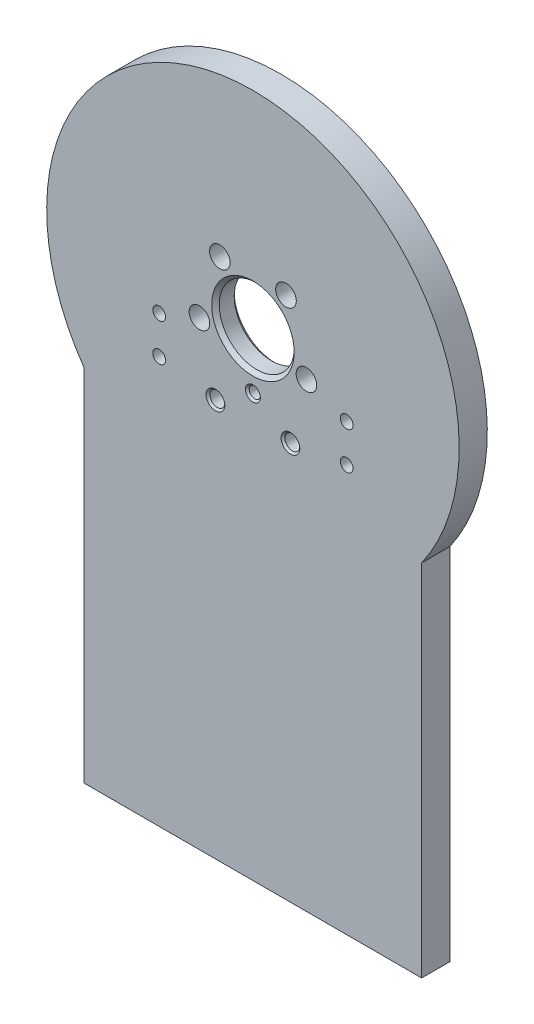
from build123d import *

# Parameters (mm, degrees)
SKETCH_2_R                = 150
EXTRUDE_1_DEPTH           = 15
SKETCH_3_R                = 35
CUT_EXTRUDE_1_DEPTH       = 3
EXTRUDE_START             = 16.5
SKETCH_4_R                = 38.5
SKETCH_4_R_2              = 35
EXTRUDE_2_DEPTH           = 16.5
EXTRUDE_START_2           = 13.5
SKETCH_5_R                = 46.5
SKETCH_5_R_2              = 38.5
EXTRUDE_3_DEPTH           = 13.5
CHAMFER_1_SIZE            = 0.5
HOLE_WIZARD_1_D           = 6.6
HOLE_WIZARD_1_CBORE_D     = 11
HOLE_WIZARD_1_CBORE_DEPTH = 8
HOLE_WIZARD_6_0_6_1_D     = 6
CHAMFER_3_SIZE            = 1
CUT_EXTRUDE_START         = 69
SKETCH_20_R               = 46.5
CUT_EXTRUDE_5_DEPTH       = 69
SKETCH_22_R               = 4
CUT_EXTRUDE_7_DEPTH       = 244.812402925
CHAMFER_6_SIZE            = 1
HOLE_WIZARD_M8_1_D        = 6.8
EXTRUDE_START_3           = 5
SKETCH_27_R               = 40
SKETCH_27_R_2             = 35
EXTRUDE_4_DEPTH           = 5
CHAMFER_7_SIZE            = 0.5
CHAMFER_8_SIZE            = 2
SKETCH_25_R               = 20
CUT_EXTRUDE_8_DEPTH       = 245.171021663
CHAMFER_9_SIZE            = 2
FILLET_1_R                = 1
SKETCH_28_OUTSIDE_W       = 386.948
SKETCH_28_OUTSIDE_H       = 386.948
SKETCH_28_OUTSIDE_R       = 110
CUT_EXTRUDE_9_DEPTH       = 245.171021663
SKETCH_29_W               = 180
SKETCH_29_H               = 198.338891977
EXTRUDE_5_DEPTH           = 15


with BuildPart() as part:
    # 草图2 → 凸台-拉伸1 (new body)
    with BuildSketch(Plane.XY.offset(1)):
        with Locations((18.556612769, -25.522523089)):
            Circle(SKETCH_2_R)
    extrude(amount=EXTRUDE_1_DEPTH)

    # 草图3 → 切除-拉伸1 (cut)
    with BuildSketch(Plane(origin=(0, 0, 1), x_dir=(-1, 0, 0), z_dir=(0, 0, -1))):
        with Locations((-18.556612769, -25.522523089)):
            Circle(SKETCH_3_R)
    extrude(amount=-CUT_EXTRUDE_1_DEPTH, mode=Mode.SUBTRACT)

    # 草图4 → 凸台-拉伸2 (add)
    with BuildSketch(Plane(origin=(0, 0, 1), x_dir=(-1, 0, 0), z_dir=(0, 0, -1)).offset(EXTRUDE_START)):
        with Locations(Location((-18.556612769, -25.522523089, 0), (0, 0, 180))):
            Circle(SKETCH_4_R)
        with Locations((-18.556612769, -25.522523089)):
            Circle(SKETCH_4_R_2, mode=Mode.SUBTRACT)
    extrude(amount=-EXTRUDE_2_DEPTH)

    # 草图5 → 凸台-拉伸3 (add)
    with BuildSketch(Plane(origin=(0, 0, 1), x_dir=(-1, 0, 0), z_dir=(0, 0, -1)).offset(EXTRUDE_START_2)):
        with Locations(Location((-18.556612769, -25.522523089, 0), (0, 0, 180))):
            Circle(SKETCH_5_R)
        with Locations(Location((-18.556612769, -25.522523089, 0), (0, 0, 90))):
            Circle(SKETCH_5_R_2, mode=Mode.SUBTRACT)
    extrude(amount=-EXTRUDE_3_DEPTH)

    # 倒角1
    chamfer_1_edges = [part.edges().sort_by_distance(p)[0] for p in [
        (53.556612769, -25.522523089, -15.5),
        (-19.943387231, -25.522523089, -15.5),
    ]]
    chamfer(chamfer_1_edges, length=CHAMFER_1_SIZE)

    # 打孔尺寸根据内六角圆柱头螺钉的类型1 (through all)
    with Locations(Plane(origin=(42.626407432, -13.463363362, 16), x_dir=(1, 0, 0), z_dir=(0, 0, 1))):
        with Locations((-41.703352232, 12.211350104), (-6.436237094, 12.211350104), (4.461900826, -21.329669558), (-52.601490152, -21.329669558)):
            CounterBoreHole(HOLE_WIZARD_1_D / 2, HOLE_WIZARD_1_CBORE_D / 2, HOLE_WIZARD_1_CBORE_DEPTH)

    # Ø6.0 (6) 直径孔1 (through all)
    with Locations(Plane.XY.offset(16)):
        with Locations((18.556612769, -55.522523089)):
            Hole(HOLE_WIZARD_6_0_6_1_D / 2)

    # 倒角3
    chamfer_3_edges = [part.edges().sort_by_distance(p)[0] for p in [
        (21.556612769, -55.522523089, 16),
    ]]
    chamfer(chamfer_3_edges, length=CHAMFER_3_SIZE)

    # 草图20 → 切除-拉伸5 (cut)
    with BuildSketch(Plane(origin=(0, 0, 1), x_dir=(-1, 0, 0), z_dir=(0, 0, -1)).offset(CUT_EXTRUDE_START)):
        with Locations((-18.556612769, -25.522523089)):
            Circle(SKETCH_20_R)
    extrude(amount=-CUT_EXTRUDE_5_DEPTH, mode=Mode.SUBTRACT)

    # 草图22 → 切除-拉伸7 (cut, through all)
    with BuildSketch(Plane.XY.offset(16)):
        with Locations((-1.443387231, -68.522523089)):
            Circle(SKETCH_22_R)
        with Locations((38.556612769, -68.522523089)):
            Circle(SKETCH_22_R)
    extrude(amount=-CUT_EXTRUDE_7_DEPTH, mode=Mode.SUBTRACT)

    # 倒角6
    chamfer_6_edges = [part.edges().sort_by_distance(p)[0] for p in [
        (-5.443387231, -68.522523089, 16),
        (34.556612769, -68.522523089, 16),
    ]]
    chamfer(chamfer_6_edges, length=CHAMFER_6_SIZE)

    # M8 螺纹孔1 (through all)
    with Locations(Plane.XY.offset(16)):
        with Locations((-31.443387231, -43.522523089), (-31.443387231, -63.522523089), (68.556612769, -43.522523089), (68.556612769, -63.522523089), (18.556612769, -25.522523089)):
            Hole(HOLE_WIZARD_M8_1_D / 2)

    # 草图27 → 凸台-拉伸4 (add)
    with BuildSketch(Plane(origin=(0, 0, 1), x_dir=(-1, 0, 0), z_dir=(0, 0, -1)).offset(EXTRUDE_START_3)):
        with Locations(Location((-18.556612769, -25.522523089, 0), (0, 0, 180))):
            Circle(SKETCH_27_R)
        with Locations((-18.556612769, -25.522523089)):
            Circle(SKETCH_27_R_2, mode=Mode.SUBTRACT)
    extrude(amount=-EXTRUDE_4_DEPTH)

    # 倒角7
    chamfer_7_edges = [part.edges().sort_by_distance(p)[0] for p in [
        (53.556612769, -25.522523089, -4),
    ]]
    chamfer(chamfer_7_edges, length=CHAMFER_7_SIZE)

    # 倒角8
    chamfer_8_edges = [part.edges().sort_by_distance(p)[0] for p in [
        (-131.443387231, -25.522523089, 1),
        (-131.443387231, -25.522523089, 16),
    ]]
    chamfer(chamfer_8_edges, length=CHAMFER_8_SIZE)

    # 草图25 → 切除-拉伸8 (cut, through all)
    with BuildSketch(Plane.XY.offset(16)):
        with Locations((18.556612769, -25.522523089)):
            Circle(SKETCH_25_R)
    extrude(amount=-CUT_EXTRUDE_8_DEPTH, mode=Mode.SUBTRACT)

    # 倒角9
    chamfer_9_edges = [part.edges().sort_by_distance(p)[0] for p in [
        (-1.443387231, -25.522523089, 4),
        (-1.443387231, -25.522523089, 16),
    ]]
    chamfer(chamfer_9_edges, length=CHAMFER_9_SIZE)

    # 圆角1
    fillet_1_edges = [part.edges().sort_by_distance(p)[0] for p in [
        (-21.443387231, -25.522523089, 1),
    ]]
    fillet(fillet_1_edges, radius=FILLET_1_R)

    # 草图28 outside → 切除-拉伸9 (cut, through all)
    with BuildSketch(Plane.XY.offset(16)):
        with Locations((18.557, -25.523)):
            Rectangle(SKETCH_28_OUTSIDE_W, SKETCH_28_OUTSIDE_H)
        with Locations((18.556612769, -25.522523089)):
            Circle(SKETCH_28_OUTSIDE_R, mode=Mode.SUBTRACT)
    extrude(amount=-CUT_EXTRUDE_9_DEPTH, mode=Mode.SUBTRACT)

    # 草图29 → 凸台-拉伸5 (add)
    with BuildSketch(Plane.XY.offset(16)):
        with Locations((18.556612769, -181.353077101)):
            Rectangle(SKETCH_29_W, SKETCH_29_H)
    extrude(amount=-EXTRUDE_5_DEPTH)


solid = part.part
